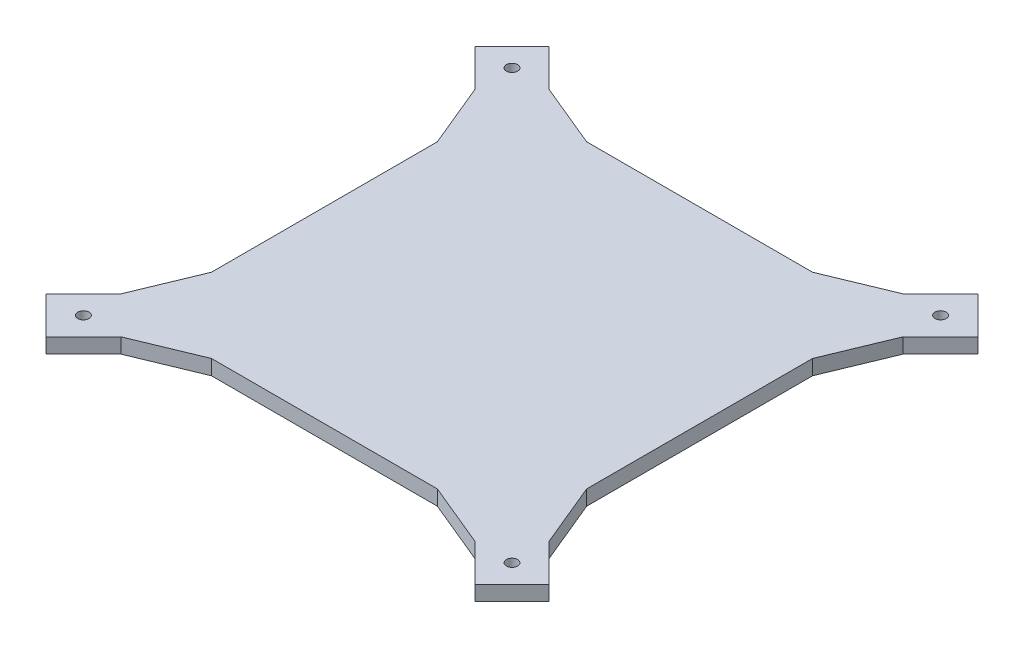
from build123d import *

# Parameters (mm, degrees)
SKETCH1_R           = 1.5
BOSS_EXTRUDE2_DEPTH = 4


with BuildPart() as part:
    # Sketch1 → Boss-Extrude2 (new body)
    with BuildSketch(Plane(origin=(0, 0, 0), x_dir=(1, 0, 0), z_dir=(0, 1, 0))):
        Polygon((-30.100505063, -50), (30.100505063, -50), (47.171572875, -57.071067812), (57.142268085, -67.041763021), (67.041763021, -57.142268085), (57.071067812, -47.171572875), (50, -30.100505063), (50, 30.100505063), (57.071067812, 47.171572875), (67.041763021, 57.142268085), (57.142268085, 67.041763021), (47.171572875, 57.071067812), (30.100505063, 50), (-30.100505063, 50), (-47.171572875, 57.071067812), (-57.142268085, 67.041763021), (-67.041763021, 57.142268085), (-57.071067812, 47.171572875), (-50, 30.100505063), (-50, -30.100505063), (-57.071067812, -47.171572875), (-67.041763021, -57.142268085), (-57.142268085, -67.041763021), (-47.171572875, -57.071067812), align=None)
        with Locations(Location((-57.106667948, -57.106667948, 0), (0, 0, 270))):
            Circle(SKETCH1_R, mode=Mode.SUBTRACT)
        with Locations(Location((-57.106667948, 57.106667948, 0), (0, 0, 90))):
            Circle(SKETCH1_R, mode=Mode.SUBTRACT)
        with Locations(Location((57.106667948, -57.106667948, 0), (0, 0, 90))):
            Circle(SKETCH1_R, mode=Mode.SUBTRACT)
        with Locations(Location((57.106667948, 57.106667948, 0), (0, 0, 270))):
            Circle(SKETCH1_R, mode=Mode.SUBTRACT)
    extrude(amount=BOSS_EXTRUDE2_DEPTH)


solid = part.part
